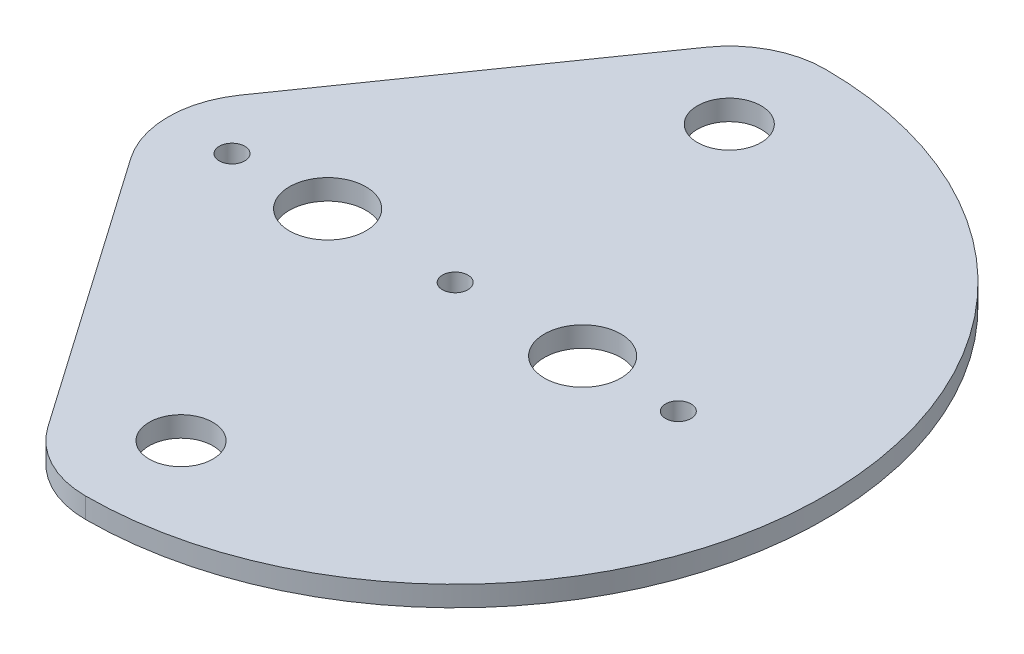
from build123d import *

# Parameters (mm, degrees)
SKETCH1_R           = 2.5
SKETCH1_R_2         = 3
SKETCH1_R_3         = 1
BOSS_EXTRUDE1_DEPTH = 0.8
BOSS_EXTRUDE2_DEPTH = 1.6


with BuildPart() as part:
    # Sketch1 → Boss-Extrude1 (new, symmetric)
    with BuildSketch(Plane(origin=(0, 0, 0), x_dir=(1, 0, 0), z_dir=(0, 1, 0))):
        with BuildLine():
            Line((-21.150952157, 4.29136197), (-6.150952157, 25.79136197))
            ThreePointArc((-6.150952157, 25.79136197), (0, 29), (6.150952157, 25.79136197))
            Line((6.150952157, 25.79136197), (21.150952157, 4.29136197))
            ThreePointArc((21.150952157, 4.29136197), (22.5, 0), (21.150952157, -4.29136197))
            Line((21.150952157, -4.29136197), (6.150952157, -25.79136197))
            ThreePointArc((6.150952157, -25.79136197), (0, -29), (-6.150952157, -25.79136197))
            Line((-6.150952157, -25.79136197), (-21.150952157, -4.29136197))
            ThreePointArc((-21.150952157, -4.29136197), (-22.5, 0), (-21.150952157, 4.29136197))
        make_face()
        with Locations(Location((0, 21.5, 0), (0, 0, 270))):
            Circle(SKETCH1_R, mode=Mode.SUBTRACT)
        with Locations(Location((0, -21.5, 0), (0, 0, 270))):
            Circle(SKETCH1_R, mode=Mode.SUBTRACT)
        with Locations(Location((-10, 0, 0), (0, 0, 270))):
            Circle(SKETCH1_R_2, mode=Mode.SUBTRACT)
        with Locations(Location((10, 0, 0), (0, 0, 270))):
            Circle(SKETCH1_R_2, mode=Mode.SUBTRACT)
        with Locations(Location((-17.5, 0, 0), (0, 0, 270))):
            Circle(SKETCH1_R_3, mode=Mode.SUBTRACT)
        with Locations(Location((0, 0, 0), (0, 0, 270))):
            Circle(SKETCH1_R_3, mode=Mode.SUBTRACT)
        with Locations(Location((17.5, 0, 0), (0, 0, 270))):
            Circle(SKETCH1_R_3, mode=Mode.SUBTRACT)
    extrude(amount=BOSS_EXTRUDE1_DEPTH, both=True)

    # Sketch2 → Boss-Extrude2 (add, through all)
    with BuildSketch(Plane(origin=(0, 0.8, 0), x_dir=(1, 0, 0), z_dir=(0, 1, 0))):
        with BuildLine():
            Line((0, -29), (22.5, 0))
            Line((22.5, 0), (0, 29))
            ThreePointArc((0, 29), (29, 0), (0, -29))
        make_face()
    extrude(amount=-BOSS_EXTRUDE2_DEPTH)


solid = part.part
